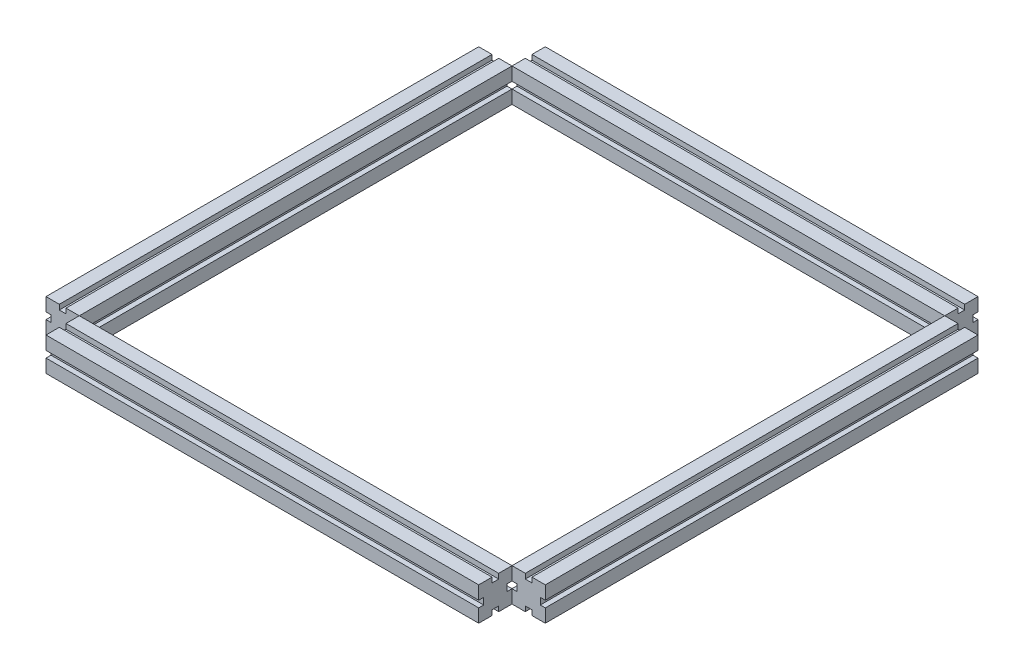
from build123d import *

# Parameters (mm, degrees)
BOSS_EXTRUDE2_DEPTH        = 280
BOSS_EXTRUDE2_DEPTH_BACK   = 280
BOSS_EXTRUDE2_2_DEPTH      = 280
BOSS_EXTRUDE2_2_DEPTH_BACK = 280
BOSS_EXTRUDE3_DEPTH        = 280
BOSS_EXTRUDE3_DEPTH_BACK   = 280
CUT_EXTRUDE1_DEPTH         = 425.735211632
CUT_EXTRUDE1_DEPTH_BACK    = 425.735211632
SKETCH6_W                  = 40
SKETCH6_H                  = 40


with BuildPart() as part:
    # Sketch4 → Boss-Extrude2 (new, two sides: drawn at the far end of the back side and taken through both)
    with BuildSketch(Plane.XY.offset(-BOSS_EXTRUDE2_DEPTH_BACK)):
        Polygon((300, -20), (284, -20), (284, -14), (276, -14), (276, -20), (260, -20), (260, -4), (266, -4), (266, 4), (260, 4), (260, 20), (276, 20), (276, 14), (284, 14), (284, 20), (300, 20), (300, 4), (294, 4), (294, -4), (300, -4), align=None)
    extrude(amount=BOSS_EXTRUDE2_DEPTH + BOSS_EXTRUDE2_DEPTH_BACK)

    # Sketch5 → Boss-Extrude3 (add, two sides: drawn at the far end of the back side and taken through both)
    with BuildSketch(Plane(origin=(0, 0, 0), x_dir=(0, 0, -1), z_dir=(1, 0, 0)).offset(-BOSS_EXTRUDE3_DEPTH_BACK)):
        Polygon((300, -20), (284, -20), (284, -14), (276, -14), (276, -20), (260, -20), (260, -4), (266, -4), (266, 4), (260, 4), (260, 20), (276, 20), (276, 14), (284, 14), (284, 20), (300, 20), (300, 4), (294, 4), (294, -4), (300, -4), align=None)
        Polygon((-276, 20), (-260, 20), (-260, 4), (-266, 4), (-266, -4), (-260, -4), (-260, -20), (-276, -20), (-276, -14), (-284, -14), (-284, -20), (-300, -20), (-300, -4), (-294, -4), (-294, 4), (-300, 4), (-300, 20), (-284, 20), (-284, 14), (-276, 14), align=None)
    extrude(amount=BOSS_EXTRUDE3_DEPTH + BOSS_EXTRUDE3_DEPTH_BACK)


with BuildPart() as body_2:
    # Sketch4 → Boss-Extrude2 2 (new, two sides: drawn at the far end of the back side and taken through both)
    with BuildSketch(Plane.XY.offset(-BOSS_EXTRUDE2_2_DEPTH_BACK)):
        Polygon((-276, 20), (-260, 20), (-260, 4), (-266, 4), (-266, -4), (-260, -4), (-260, -20), (-276, -20), (-276, -14), (-284, -14), (-284, -20), (-300, -20), (-300, -4), (-294, -4), (-294, 4), (-300, 4), (-300, 20), (-284, 20), (-284, 14), (-276, 14), align=None)
    extrude(amount=BOSS_EXTRUDE2_2_DEPTH + BOSS_EXTRUDE2_2_DEPTH_BACK)


with BuildPart() as cut_extrude1_tool:
    # Sketch6 → Cut-Extrude1 (new, two sides: drawn at the far end of the back side and taken through both)
    with BuildSketch(Plane(origin=(0, 0, 0), x_dir=(1, 0, 0), z_dir=(0, 1, 0)).offset(-CUT_EXTRUDE1_DEPTH_BACK)):
        with Locations((-280, 280)):
            Rectangle(SKETCH6_W, SKETCH6_H)
        with Locations((-280, -280)):
            Rectangle(SKETCH6_W, SKETCH6_H)
        with Locations((280, -280)):
            Rectangle(SKETCH6_W, SKETCH6_H)
        with Locations((280, 280)):
            Rectangle(SKETCH6_W, SKETCH6_H)
    extrude(amount=CUT_EXTRUDE1_DEPTH + CUT_EXTRUDE1_DEPTH_BACK)


with BuildPart() as part_1:
    add(part.part)

    # Cut-Extrude1: cut by cut_extrude1_tool
    add(cut_extrude1_tool.part, mode=Mode.SUBTRACT)


with BuildPart() as body_2_1:
    add(body_2.part)

    # Cut-Extrude1: cut by cut_extrude1_tool
    add(cut_extrude1_tool.part, mode=Mode.SUBTRACT)


solid = Compound([part_1.part, body_2_1.part])
